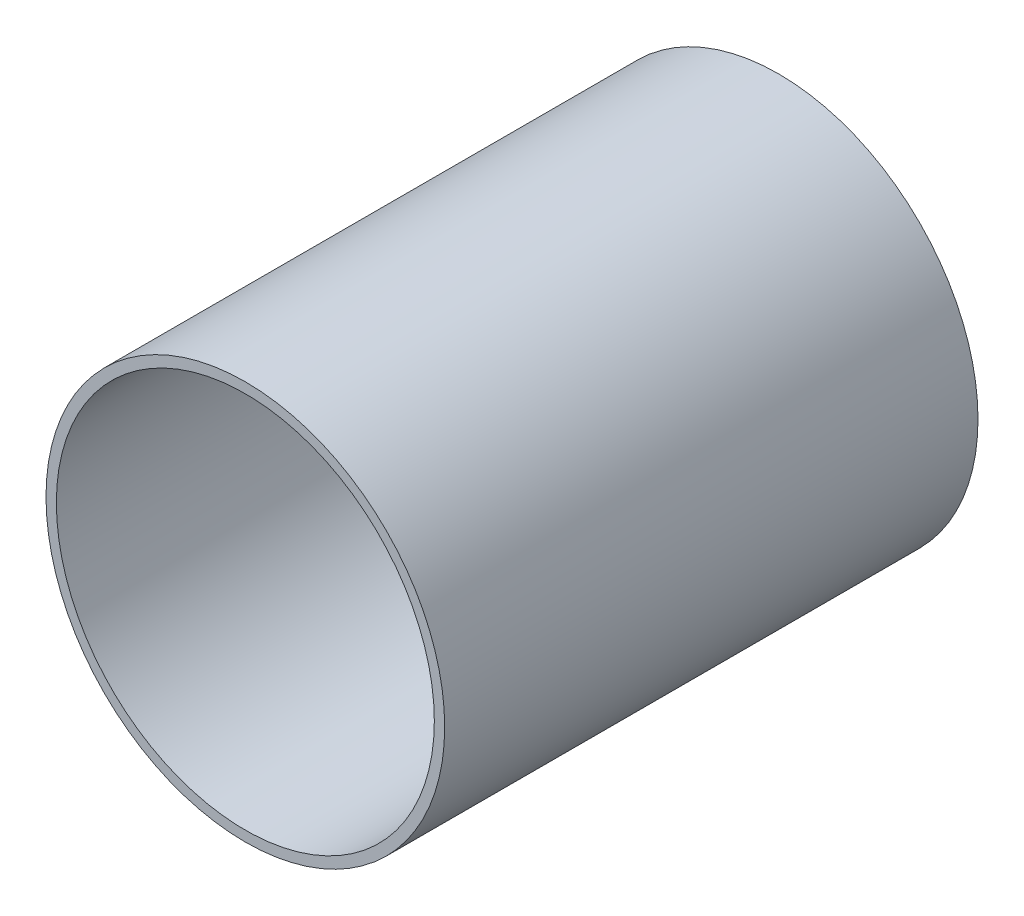
from build123d import *

# Parameters (mm, degrees)
ESBO_O1_R                = 3.85
ESBO_O1_R_2              = 3.65
RESSALTO_EXTRUS_O1_DEPTH = 10.3


with BuildPart() as part:
    # Esboço1 → Ressalto-extrusão1 (new body)
    with BuildSketch(Plane.XY):
        with Locations(Location((0, 0, 0), (0, 0, 180))):
            Circle(ESBO_O1_R)
        with Locations(Location((0, 0, 0), (0, 0, 180))):
            Circle(ESBO_O1_R_2, mode=Mode.SUBTRACT)
    extrude(amount=RESSALTO_EXTRUS_O1_DEPTH)


solid = part.part
